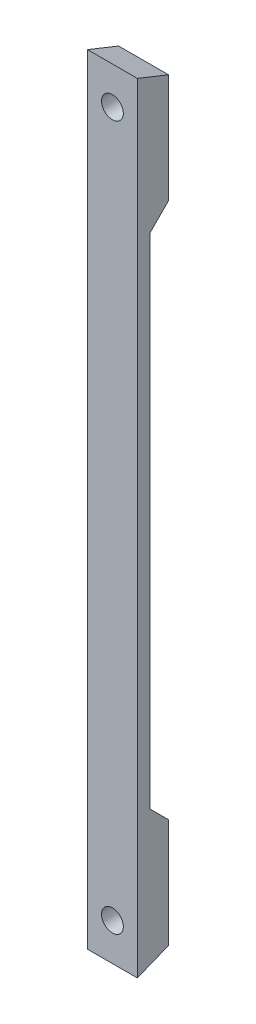
from build123d import *

# Parameters (mm, degrees)
SKETCH1_W           = 125
SKETCH1_H           = 8
SKETCH1_R           = 1.75
BOSS_EXTRUDE1_DEPTH = 5
CUT_EXTRUDE1_DEPTH  = 64.207990001
CHAMFER1_SIZE       = 2


with BuildPart() as part:
    # Sketch1 → Boss-Extrude1 (new body)
    with BuildSketch(Plane(origin=(0, 0, 0), x_dir=(0, 1, 0), z_dir=(0, 0, 1))):
        Rectangle(SKETCH1_W, SKETCH1_H)
        with Locations(Location((-56.5, 0, 0), (0, 0, 270))):
            Circle(SKETCH1_R, mode=Mode.SUBTRACT)
        with Locations(Location((56.5, 0, 0), (0, 0, 270))):
            Circle(SKETCH1_R, mode=Mode.SUBTRACT)
    extrude(amount=BOSS_EXTRUDE1_DEPTH)

    # Sketch2 → Cut-Extrude1 (cut, through all)
    with BuildSketch(Plane.YZ.offset(4)):
        Polygon((-40, 3), (-43, 0), (43, 0), (40, 3), align=None)
        Polygon((-60.5, 0), (-62.5, 5), (-62.5, 0), align=None)
        Polygon((62.5, 5), (60.5, 0), (62.5, 0), align=None)
    extrude(amount=-CUT_EXTRUDE1_DEPTH, mode=Mode.SUBTRACT)

    # Chamfer1
    chamfer1_edges = [part.edges().sort_by_distance(p)[0] for p in [
        (-1.75, -56.5, 0),
        (-1.75, 56.5, 0),
    ]]
    chamfer(chamfer1_edges, length=CHAMFER1_SIZE)


solid = part.part
